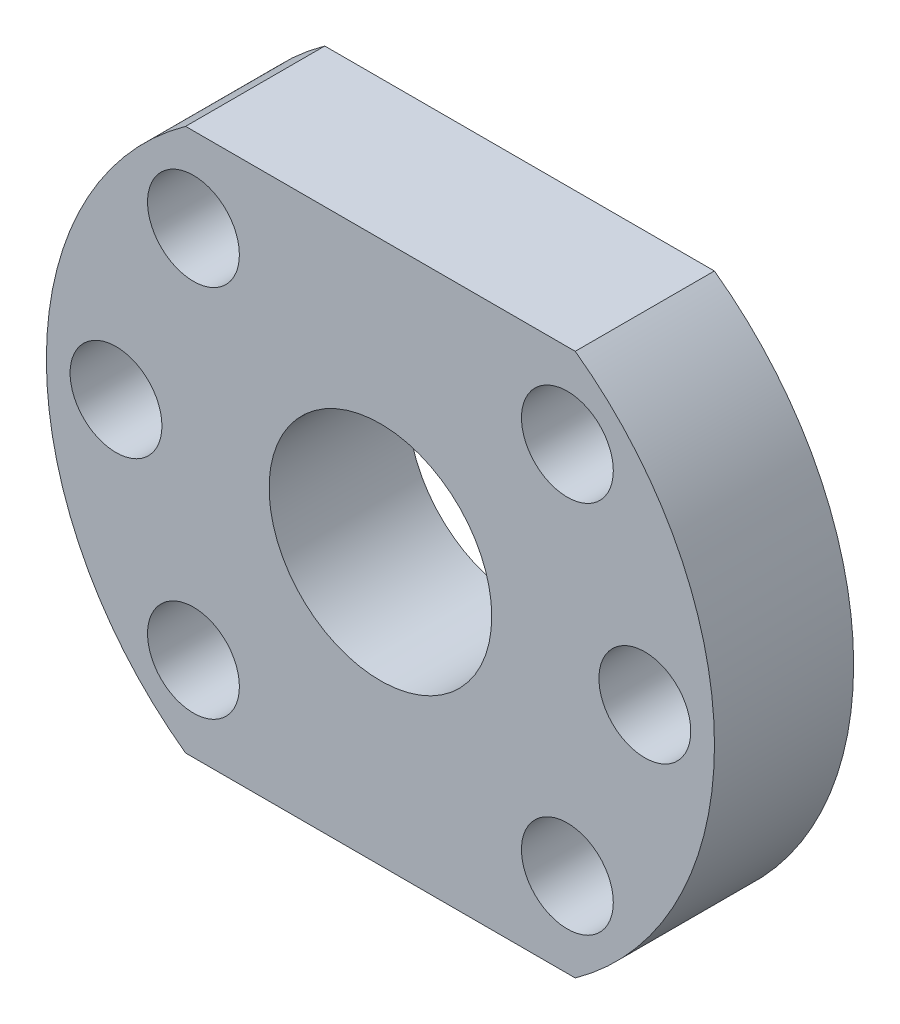
from build123d import *

# Parameters (mm, degrees)
SKETCH1_R            = 8
BOSS_EXTRUDE1_DEPTH  = 10
M6_CLEARANCE_HOLE1_D = 6.6


with BuildPart() as part:
    # Sketch1 → Boss-Extrude1 (new body)
    with BuildSketch(Plane.XY):
        with BuildLine():
            Line((-14, 19.5), (14, 19.5))
            ThreePointArc((14, 19.5), (24.005207768, 0), (14, -19.5))
            Line((14, -19.5), (-14, -19.5))
            ThreePointArc((-14, -19.5), (-24.005207768, 0), (-14, 19.5))
        make_face()
        Circle(SKETCH1_R, mode=Mode.SUBTRACT)
    extrude(amount=BOSS_EXTRUDE1_DEPTH)

    # M6 Clearance Hole1 (through all)
    with Locations(Plane.XY.offset(10)):
        with Locations((-13.435028843, 13.435028843), (13.435028843, 13.435028843), (19, 0), (13.435028843, -13.435028843), (-13.435028843, -13.435028843), (-19, 0)):
            Hole(M6_CLEARANCE_HOLE1_D / 2)


solid = part.part
